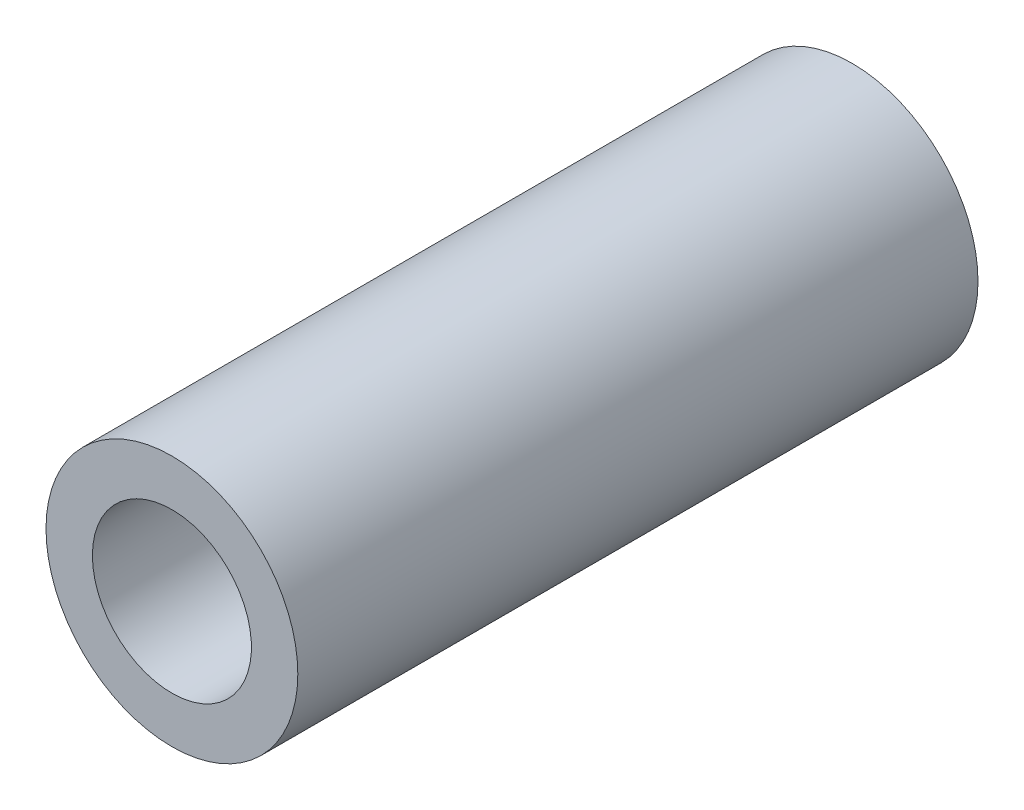
from build123d import *

# Parameters (mm, degrees)
SKETCH1_R      = 2.375
SKETCH1_R_2    = 1.5
EXTRUDE1_DEPTH = 6.415


with BuildPart() as part:
    # Sketch1 → Extrude1 (new, symmetric)
    with BuildSketch(Plane.XY):
        with Locations(Location((0, 0, 0), (0, 0, 180))):
            Circle(SKETCH1_R)
        with Locations(Location((0, 0, 0), (0, 0, 180))):
            Circle(SKETCH1_R_2, mode=Mode.SUBTRACT)
    extrude(amount=EXTRUDE1_DEPTH, both=True)


solid = part.part
